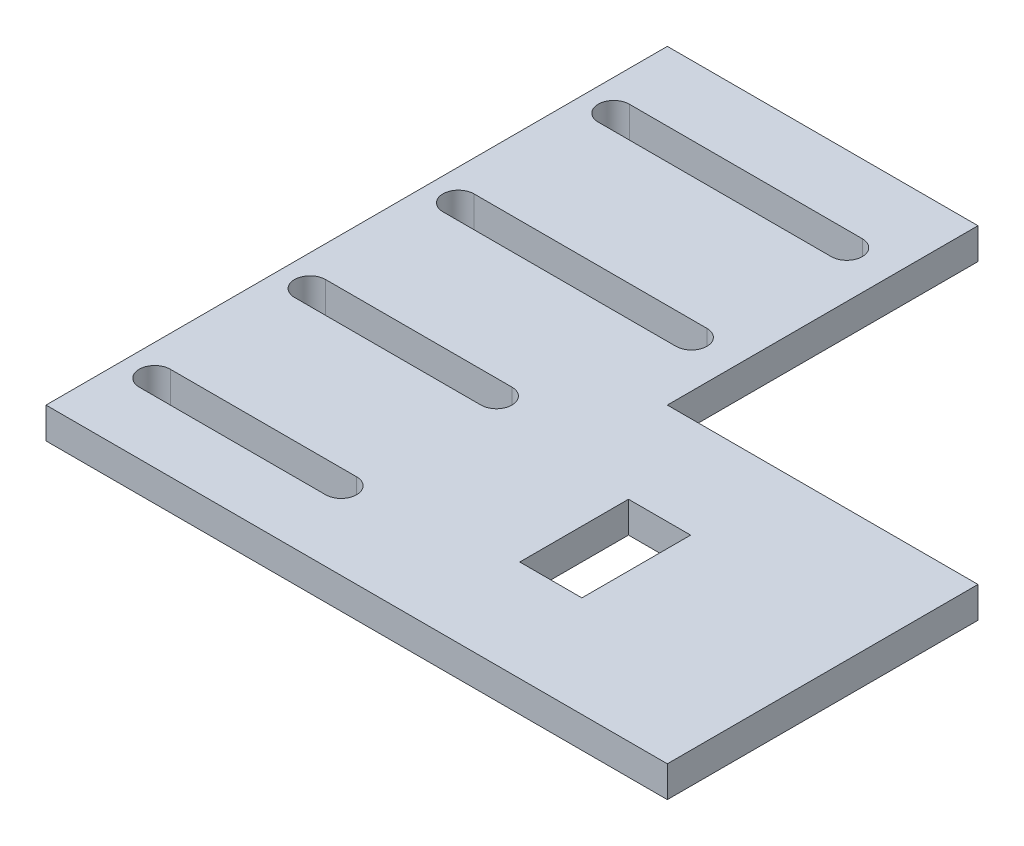
from build123d import *

# Parameters (mm, degrees)
SKETCH2_W           = 100
SKETCH2_H           = 50
BOSS_EXTRUDE1_DEPTH = 5
SKETCH3_W           = 10
SKETCH3_H           = 17.5
CUT_EXTRUDE1_DEPTH  = 7.5
CUT_EXTRUDE2_DEPTH  = 7.5
SKETCH5_W           = 50
SKETCH5_H           = 50
BOSS_EXTRUDE2_DEPTH = 5
CUT_EXTRUDE3_DEPTH  = 10
LPATTERN1_COUNT     = 2
LPATTERN1_PITCH     = 25


with BuildPart() as part:
    # Sketch2 → Boss-Extrude1 (new body)
    with BuildSketch(Plane(origin=(0, 0, 0), x_dir=(1, 0, 0), z_dir=(0, 1, 0))):
        Rectangle(SKETCH2_W, SKETCH2_H)
    extrude(amount=BOSS_EXTRUDE1_DEPTH)

    # Sketch3 → Cut-Extrude1 (cut)
    with BuildSketch(Plane(origin=(0, 5, 0), x_dir=(1, 0, 0), z_dir=(0, 1, 0))):
        with Locations((15, 0)):
            Rectangle(SKETCH3_W, SKETCH3_H)
    extrude(amount=-CUT_EXTRUDE1_DEPTH, mode=Mode.SUBTRACT)

    # Sketch4 → Cut-Extrude2 (cut)
    with BuildSketch(Plane(origin=(0, 5, 0), x_dir=(1, 0, 0), z_dir=(0, 1, 0))):
        with BuildLine():
            Line((-45, 15), (-15, 15))
            ThreePointArc((-15, 15), (-12.5, 12.5), (-15, 10))
            Line((-15, 10), (-45, 10))
            ThreePointArc((-45, 10), (-47.5, 12.5), (-45, 15))
        make_face()
        with BuildLine():
            Line((-45, -15), (-15, -15))
            ThreePointArc((-15, -15), (-12.5, -12.5), (-15, -10))
            Line((-15, -10), (-45, -10))
            ThreePointArc((-45, -10), (-47.5, -12.5), (-45, -15))
        make_face()
    extrude(amount=-CUT_EXTRUDE2_DEPTH, mode=Mode.SUBTRACT)

    # Sketch5 → Boss-Extrude2 (add)
    with BuildSketch(Plane(origin=(0, 5, 0), x_dir=(1, 0, 0), z_dir=(0, 1, 0))):
        with Locations((-25, 50)):
            Rectangle(SKETCH5_W, SKETCH5_H)
    extrude(amount=-BOSS_EXTRUDE2_DEPTH)

    # Sketch6 → Cut-Extrude3 (cut)
    with BuildSketch(Plane(origin=(0, 5, 0), x_dir=(1, 0, 0), z_dir=(0, 1, 0))):
        with BuildLine():
            Line((-45, 38.880259694), (-7.5, 38.880259694))
            ThreePointArc((-7.5, 38.880259694), (-5, 36.380259694), (-7.5, 33.880259694))
            Line((-7.5, 33.880259694), (-45, 33.880259694))
            ThreePointArc((-45, 33.880259694), (-47.5, 36.380259694), (-45, 38.880259694))
        make_face()
    cut_extrude3 = extrude(amount=-CUT_EXTRUDE3_DEPTH, mode=Mode.SUBTRACT)

    # LPattern1: Cut-Extrude3 ×2
    with Locations(*[(0, 0, -i * LPATTERN1_PITCH) for i in range(1, LPATTERN1_COUNT)]):
        add(cut_extrude3, mode=Mode.SUBTRACT)


solid = part.part
